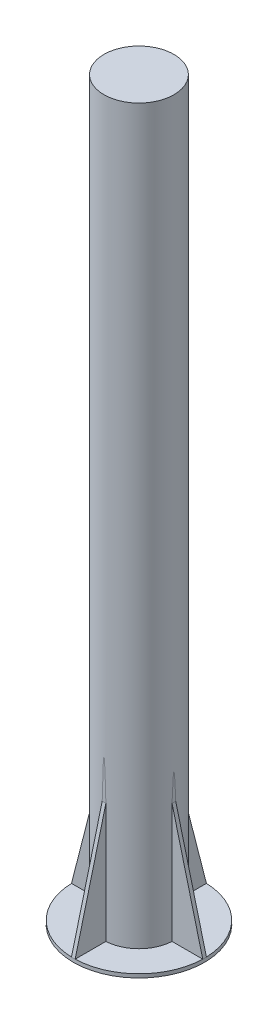
from build123d import *

# Parameters (mm, degrees)
SKETCH1_R           = 107
BOSS_EXTRUDE1_DEPTH = 6
SKETCH2_R           = 57
BOSS_EXTRUDE2_DEPTH = 1194
BOSS_EXTRUDE3_DEPTH = 195
CUT_EXTRUDE1_DEPTH  = 1210.772292624
CUT_EXTRUDE2_DEPTH  = 1210.772292624


with BuildPart() as part:
    # Sketch1 → Boss-Extrude1 (new body)
    with BuildSketch(Plane(origin=(0, 0, 0), x_dir=(1, 0, 0), z_dir=(0, 1, 0))):
        with Locations(Location((0, 0, 0), (0, 0, 270))):
            Circle(SKETCH1_R)
    extrude(amount=BOSS_EXTRUDE1_DEPTH)

    # Sketch2 → Boss-Extrude2 (add)
    with BuildSketch(Plane(origin=(0, 6, 0), x_dir=(1, 0, 0), z_dir=(0, 1, 0))):
        with Locations(Location((0, 0, 0), (0, 0, 270))):
            Circle(SKETCH2_R)
    extrude(amount=BOSS_EXTRUDE2_DEPTH)

    # Sketch3 → Boss-Extrude3 (add)
    with BuildSketch(Plane(origin=(0, 6, 0), x_dir=(1, 0, 0), z_dir=(0, 1, 0))):
        Polygon((-107, 0), (-107, -3), (-3, -3), (-3, -107), (3, -107), (3, -3), (107, -3), (107, 3), (3, 3), (3, 107), (0, 107), (-3, 107), (-3, 3), (-107, 3), align=None)
    extrude(amount=BOSS_EXTRUDE3_DEPTH)

    # Sketch4 → Cut-Extrude1 (cut, through all)
    with BuildSketch(Plane.XY.offset(3)):
        Polygon((-56.920997883, 201), (-107, 6), (-153.843462946, 6), (-153.843462946, 243.950118008), (-57, 243.950118008), align=None)
        Polygon((107, 6), (56.920997883, 201), (57, 243.950118008), (157.678532458, 243.950118008), (157.678532458, 6), align=None)
    extrude(amount=-CUT_EXTRUDE1_DEPTH, mode=Mode.SUBTRACT)

    # Sketch6 → Cut-Extrude2 (cut, through all)
    with BuildSketch(Plane.ZY.offset(3)):
        Polygon((-107, 6), (-56.920997883, 201), (-57, 265.799576447), (-234.352889602, 265.799576447), (-234.352889602, 6), align=None)
        Polygon((107, 6), (56.920997883, 201), (57, 265.799576447), (191.443205591, 265.799576447), (191.443205591, 6), align=None)
    extrude(amount=-CUT_EXTRUDE2_DEPTH, mode=Mode.SUBTRACT)


solid = part.part
